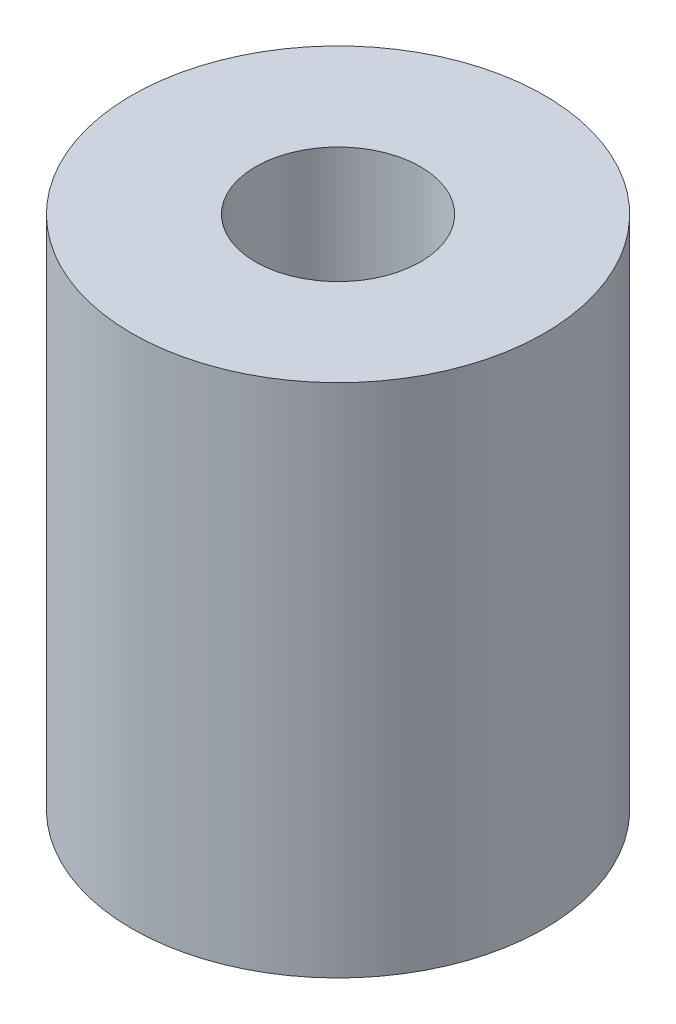
from build123d import *

# Parameters (mm, degrees)
SKETCH_1_R      = 10
SKETCH_1_R_2    = 2.5
EXTRUDE_1_DEPTH = 12.5
SKETCH_2_R      = 10
SKETCH_2_R_2    = 4
EXTRUDE_2_DEPTH = 12.5


with BuildPart() as part:
    # 草图1 → 凸台-拉伸1 (new body)
    with BuildSketch(Plane(origin=(0, 0, 0), x_dir=(1, 0, 0), z_dir=(0, 1, 0))):
        with Locations(Location((0, 0, 0), (0, 0, 270))):
            Circle(SKETCH_1_R)
        with Locations(Location((0, 0, 0), (0, 0, 270))):
            Circle(SKETCH_1_R_2, mode=Mode.SUBTRACT)
    extrude(amount=EXTRUDE_1_DEPTH)

    # 草图2 → 凸台-拉伸2 (add)
    with BuildSketch(Plane(origin=(0, 12.5, 0), x_dir=(1, 0, 0), z_dir=(0, 1, 0))):
        with Locations(Location((0, 0, 0), (0, 0, 270))):
            Circle(SKETCH_2_R)
        with Locations(Location((0, 0, 0), (0, 0, 270))):
            Circle(SKETCH_2_R_2, mode=Mode.SUBTRACT)
    extrude(amount=EXTRUDE_2_DEPTH)


solid = part.part
